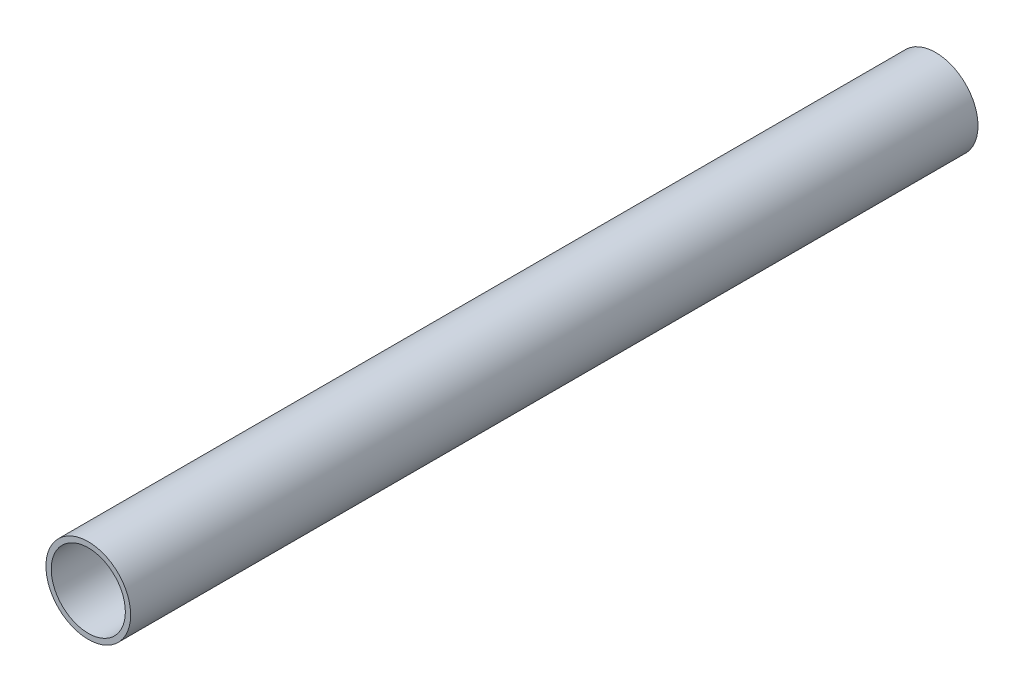
from build123d import *

# Parameters (mm, degrees)
SKETCH2_R           = 12.7
SKETCH2_R_2         = 11.1125
BOSS_EXTRUDE1_DEPTH = 127
SKETCH3_R           = 2.4892
CUT_EXTRUDE1_DEPTH  = 129.263712717


with BuildPart() as part:
    # Sketch2 → Boss-Extrude1 (new, symmetric)
    with BuildSketch(Plane.XY):
        Circle(SKETCH2_R)
        Circle(SKETCH2_R_2, mode=Mode.SUBTRACT)
    extrude(amount=BOSS_EXTRUDE1_DEPTH, both=True)

    # Sketch3 → Cut-Extrude1 (cut, through all)
    with BuildSketch(Plane(origin=(0, 0, 0), x_dir=(1, 0, 0), z_dir=(0, 1, 0))):
        with Locations(Location((0, 0, 0), (0, 0, 270))):
            Circle(SKETCH3_R)
    extrude(amount=-CUT_EXTRUDE1_DEPTH, mode=Mode.SUBTRACT)


solid = part.part
